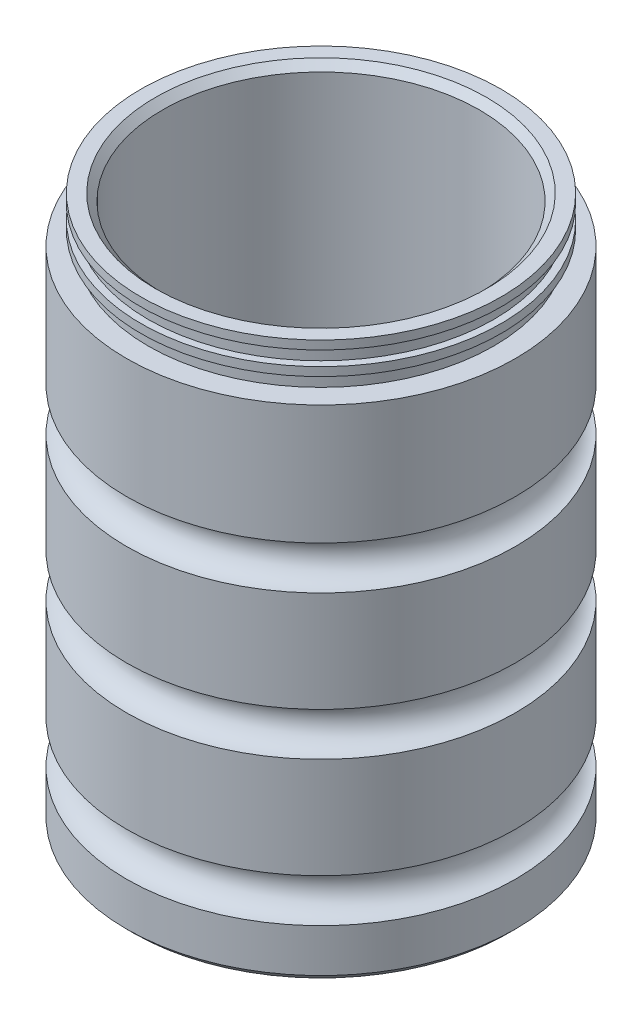
from build123d import *

# Parameters (mm, degrees)
ESQUISSE2_R             = 2.5
ENL_V_MAT_EXTRU_1_DEPTH = 10
ESQUISSE4_R             = 2
ENL_V_MAT_EXTRU_3_DEPTH = 43.52646235
CHANFREIN4_SIZE         = 0.5
CHANFREIN2_SIZE         = 0.5
CHANFREIN3_SIZE         = 0.5


with BuildPart() as part:
    # Esquisse1 → Révolution1 (revolve)
    with BuildSketch(Plane.XY, mode=Mode.PRIVATE) as r_volution1_sk:
        with BuildLine():
            Line((0, 0), (-13.5, 0))
            Line((-13.5, 0), (-13.5, 3.5))
            ThreePointArc((-13.5, 3.5), (-12, 5), (-13.5, 6.5))
            Line((-13.5, 6.5), (-13.5, 13.5))
            ThreePointArc((-13.5, 13.5), (-12, 15), (-13.5, 16.5))
            Line((-13.5, 16.5), (-13.5, 23.5))
            ThreePointArc((-13.5, 23.5), (-12, 25), (-13.5, 26.5))
            Line((-13.5, 26.5), (-13.5, 34.8))
            Line((-13.5, 34.8), (-12.5, 34.8))
            Line((-12.5, 34.8), (-12, 34.8))
            Line((-12, 34.8), (-12, 35.8))
            Line((-12, 35.8), (-12.5, 35.8))
            Line((-12.5, 35.8), (-12.5, 36.4))
            Line((-12.5, 36.4), (-12, 36.4))
            Line((-12, 36.4), (-12, 37.4))
            Line((-12, 37.4), (-12.5, 37.4))
            Line((-12.5, 37.4), (-12.5, 38))
            Line((-12.5, 38), (-11, 38))
            Line((-11, 38), (-11, 33))
            Line((-11, 33), (-11, 12))
            Line((-11, 12), (0, 12))
            Line((0, 12), (0, 3))
            Line((0, 3), (0, 0))
        make_face()
    revolve(r_volution1_sk.sketch.rotate(Axis((0, -29.115408637, 0), (0, 1, 0)), 270), axis=Axis((0, -29.115408637, 0), (0, 1, 0)))

    # Esquisse2 → Enlèv. mat.-Extru.1 (cut)
    with BuildSketch(Plane.XZ):
        with Locations(Location((8, 0, 0), (0, 0, 270))):
            Circle(ESQUISSE2_R)
        with Locations(Location((-8, 0, 0), (0, 0, 270))):
            Circle(ESQUISSE2_R)
    extrude(amount=-ENL_V_MAT_EXTRU_1_DEPTH, mode=Mode.SUBTRACT)

    # Esquisse4 → Enlèv. mat.-Extru.3 (cut, through all)
    with BuildSketch(Plane.XZ):
        with Locations(Location((0, 0, 0), (0, 0, 270))):
            Circle(ESQUISSE4_R)
    extrude(amount=-ENL_V_MAT_EXTRU_3_DEPTH, mode=Mode.SUBTRACT)

    # Chanfrein4
    chanfrein4_edges = [part.edges().sort_by_distance(p)[0] for p in [
        (0, 12, 2),
        (0, 0, 2),
    ]]
    chamfer(chanfrein4_edges, length=CHANFREIN4_SIZE)

    # Chanfrein2
    chanfrein2_edges = [part.edges().sort_by_distance(p)[0] for p in [
        (8, 0, 2.5),
        (-8, 0, 2.5),
    ]]
    chamfer(chanfrein2_edges, length=CHANFREIN2_SIZE)

    # Chanfrein3
    chanfrein3_edges = [part.edges().sort_by_distance(p)[0] for p in [
        (0, 38, 11),
        (0, 0, 13.5),
    ]]
    chamfer(chanfrein3_edges, length=CHANFREIN3_SIZE)


solid = part.part
